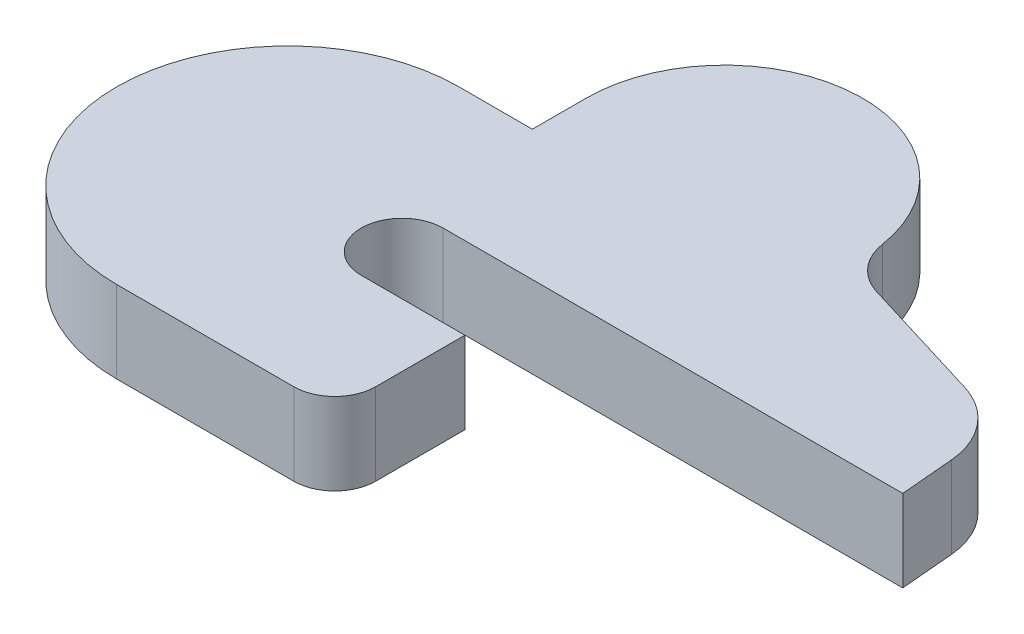
from build123d import *

# Parameters (mm, degrees)
BOSS_EXTRUDE2_DEPTH = 3


with BuildPart() as part:
    # Sketch1 → Boss-Extrude2 (new body)
    with BuildSketch(Plane(origin=(0, 0, 0), x_dir=(1, 0, 0), z_dir=(0, 1, 0))):
        with BuildLine():
            Line((0, 0), (-3.8, 0))
            ThreePointArc((-3.8, 0), (-5.3, 1.5), (-3.8, 3))
            Line((-3.8, 3), (13.04, 3))
            Line((13.04, 3), (12.868254879, 4.963055716))
            ThreePointArc((12.868254879, 4.963055716), (12.228877244, 6.545570894), (10.813877905, 7.5))
            Line((10.813877905, 7.5), (6.156299709, 8.923964556))
            ThreePointArc((6.156299709, 8.923964556), (5.230638373, 9.525590656), (4.765198448, 10.526674344))
            ThreePointArc((4.765198448, 10.526674344), (-0.630284052, 14.79), (-5.3, 9.742136094))
            Line((-5.3, 9.742136094), (-5.3, 7.77))
            Line((-5.3, 7.77), (-7.99, 7.77))
            ThreePointArc((-7.99, 7.77), (-14.26, 1.5), (-7.99, -4.77))
            Line((-7.99, -4.77), (-1.5, -4.77))
            ThreePointArc((-1.5, -4.77), (-0.439339828, -4.330660172), (0, -3.27))
            Line((0, -3.27), (0, 0))
        make_face()
    extrude(amount=BOSS_EXTRUDE2_DEPTH)


solid = part.part
